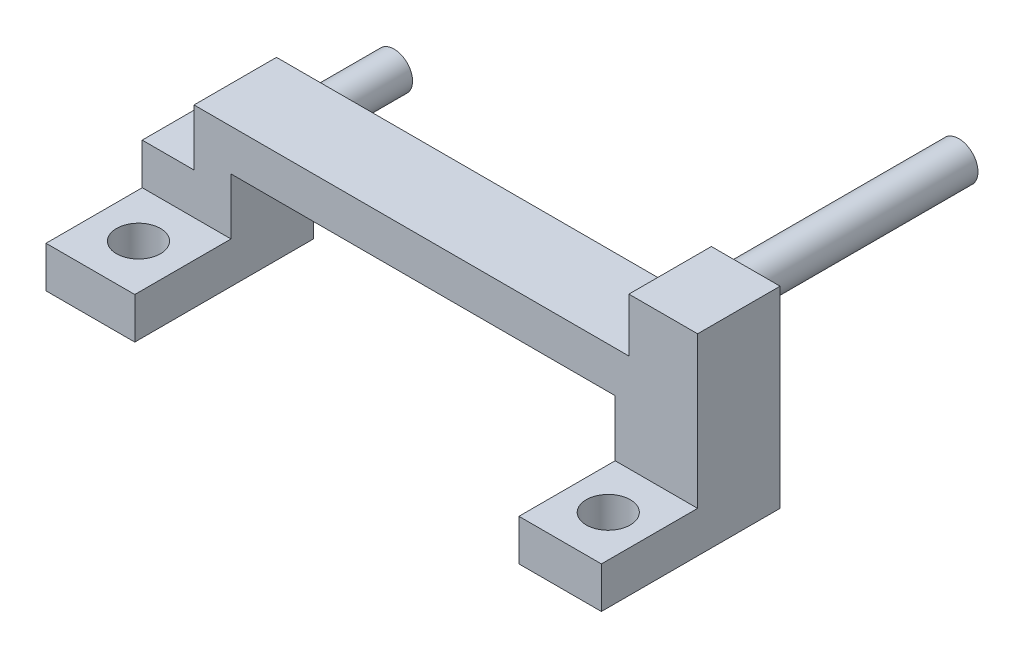
from build123d import *

# Parameters (mm, degrees)
SKETCH1_W            = 4
SKETCH1_H            = 14
BOSS_EXTRUDE1_DEPTH  = 3
SKETCH2_R            = 1.4
BOSS_EXTRUDE2_DEPTH  = 16
SKETCH3_W            = 4
SKETCH3_H            = 1
BOSS_EXTRUDE4_DEPTH  = 6
SKETCH7_W            = 3
SKETCH7_H            = 2
BOSS_EXTRUDE5_DEPTH  = 30.95
SKETCH8_W            = 3
SKETCH8_H            = 2
BOSS_EXTRUDE6_DEPTH  = 1
SKETCH9_W            = 1
SKETCH9_H            = 2
BOSS_EXTRUDE7_DEPTH  = 3
SKETCH10_W           = 1
SKETCH10_H           = 2
BOSS_EXTRUDE8_DEPTH  = 5.92
SKETCH11_W           = 1
SKETCH11_H           = 2
BOSS_EXTRUDE9_DEPTH  = 4
SKETCH12_W           = 1
SKETCH12_H           = 3
BOSS_EXTRUDE14_DEPTH = 0.93
SKETCH13_W           = 3
SKETCH13_H           = 3
BOSS_EXTRUDE15_DEPTH = 7.1
SKETCH14_W           = 3.33402541
SKETCH14_H           = 13.860919233
CUT_EXTRUDE3_DEPTH   = 10
SKETCH15_W           = 6.20666024
SKETCH15_H           = 3.660501205
CUT_EXTRUDE4_DEPTH   = 10
SKETCH16_W           = 3
SKETCH16_H           = 9.1
BOSS_EXTRUDE16_DEPTH = 0.12
SKETCH18_W           = 3
SKETCH18_H           = 9.1
BOSS_EXTRUDE18_DEPTH = 0.41
SKETCH19_W           = 3
SKETCH19_H           = 9.1
BOSS_EXTRUDE19_DEPTH = 0.89
SKETCH20_W           = 3
SKETCH20_H           = 6
BOSS_EXTRUDE20_DEPTH = 3.77
SKETCH21_R           = 1.35
BOSS_EXTRUDE23_DEPTH = 10
BOSS_EXTRUDE24_DEPTH = 3
SKETCH24_W           = 4
SKETCH24_H           = 1
BOSS_EXTRUDE25_DEPTH = 4
SKETCH25_W           = 4
SKETCH25_H           = 7
BOSS_EXTRUDE26_DEPTH = 2
SKETCH26_W           = 6.458993184
SKETCH26_H           = 3
BOSS_EXTRUDE27_DEPTH = 7
SKETCH27_R           = 1.6
CUT_EXTRUDE5_DEPTH   = 7
SKETCH28_R           = 1.6
CUT_EXTRUDE6_DEPTH   = 7
SKETCH30_W           = 7
SKETCH30_H           = 3
BOSS_EXTRUDE29_DEPTH = 1
SKETCH31_W           = 7
SKETCH31_H           = 3
BOSS_EXTRUDE30_DEPTH = 1
SKETCH32_W           = 6
SKETCH32_H           = 7.1
BOSS_EXTRUDE31_DEPTH = 1
SKETCH33_W           = 31.638993184
SKETCH33_H           = 6
BOSS_EXTRUDE32_DEPTH = 1
SKETCH34_W           = 6
SKETCH34_H           = 14
BOSS_EXTRUDE33_DEPTH = 1


with BuildPart() as part:
    # Sketch1 → Boss-Extrude1 (new body)
    with BuildSketch(Plane.XY):
        with Locations((-1.434146341, -3.597560976)):
            Rectangle(SKETCH1_W, SKETCH1_H)
    extrude(amount=BOSS_EXTRUDE1_DEPTH)

    # Sketch2 → Boss-Extrude2 (add)
    with BuildSketch(Plane(origin=(0, 0, 0), x_dir=(-1, 0, 0), z_dir=(0, 0, -1))):
        with Locations((1.434146341, 1.802439024)):
            Circle(SKETCH2_R)
    extrude(amount=BOSS_EXTRUDE2_DEPTH)

    # Sketch3 → Boss-Extrude4 (add)
    with BuildSketch(Plane.XY.offset(3)):
        with Locations((-1.434146341, -10.097560976)):
            Rectangle(SKETCH3_W, SKETCH3_H)
    extrude(amount=BOSS_EXTRUDE4_DEPTH)

    # Sketch7 → Boss-Extrude5 (add)
    with BuildSketch(Plane.ZY.offset(3.434146341)):
        with Locations((1.5, -2.497560976)):
            Rectangle(SKETCH7_W, SKETCH7_H)
    extrude(amount=BOSS_EXTRUDE5_DEPTH)

    # Sketch8 → Boss-Extrude6 (add)
    with BuildSketch(Plane.ZY.offset(34.384146341)):
        with Locations((1.5, -2.497560976)):
            Rectangle(SKETCH8_W, SKETCH8_H)
    extrude(amount=BOSS_EXTRUDE6_DEPTH)

    # Sketch9 → Boss-Extrude7 (add)
    with BuildSketch(Plane(origin=(0, 0, 0), x_dir=(-1, 0, 0), z_dir=(0, 0, -1))):
        with Locations((34.884146341, -2.497560976)):
            Rectangle(SKETCH9_W, SKETCH9_H)
    extrude(amount=BOSS_EXTRUDE7_DEPTH)

    # Sketch10 → Boss-Extrude8 (add)
    with BuildSketch(Plane(origin=(0, 0, -3), x_dir=(-1, 0, 0), z_dir=(0, 0, -1))):
        with Locations((34.884146341, -2.497560976)):
            Rectangle(SKETCH10_W, SKETCH10_H)
    extrude(amount=BOSS_EXTRUDE8_DEPTH)

    # Sketch11 → Boss-Extrude9 (add)
    with BuildSketch(Plane(origin=(0, 0, -8.92), x_dir=(-1, 0, 0), z_dir=(0, 0, -1))):
        with Locations((34.884146341, -2.497560976)):
            Rectangle(SKETCH11_W, SKETCH11_H)
    extrude(amount=BOSS_EXTRUDE9_DEPTH)

    # Sketch12 → Boss-Extrude14 (add)
    with BuildSketch(Plane.XZ.offset(3.497560976)):
        with Locations((-34.884146341, -9.28)):
            Rectangle(SKETCH12_W, SKETCH12_H)
    extrude(amount=BOSS_EXTRUDE14_DEPTH)

    # Sketch13 → Boss-Extrude15 (add)
    with BuildSketch(Plane.XZ.offset(3.497560976)):
        with Locations((-33.884146341, 1.5)):
            Rectangle(SKETCH13_W, SKETCH13_H)
    extrude(amount=BOSS_EXTRUDE15_DEPTH)

    # Sketch14 → Cut-Extrude3 (cut)
    with BuildSketch(Plane.XY.offset(3)):
        with Locations((-35.32015223, -3.66710136)):
            Rectangle(SKETCH14_W, SKETCH14_H)
    extrude(amount=-CUT_EXTRUDE3_DEPTH, mode=Mode.SUBTRACT)


with BuildPart() as cut_extrude3_piece_1:
    # of the separate pieces the step leaves, piece 1, a body of its own (cut_extrude3_pieces)
    add(part.part.solids().sort_by_distance((-3.434146341, 3.402439024, 0))[0])

    # Sketch16 → Boss-Extrude16 (add)
    with BuildSketch(Plane.ZY.offset(33.653139525)):
        with Locations((1.5, -6.047560976)):
            Rectangle(SKETCH16_W, SKETCH16_H)
    extrude(amount=BOSS_EXTRUDE16_DEPTH)

    # Sketch18 → Boss-Extrude18 (add)
    with BuildSketch(Plane.ZY.offset(33.773139525)):
        with Locations((1.5, -6.047560976)):
            Rectangle(SKETCH18_W, SKETCH18_H)
    extrude(amount=BOSS_EXTRUDE18_DEPTH)

    # Sketch19 → Boss-Extrude19 (add)
    with BuildSketch(Plane.ZY.offset(34.183139525)):
        with Locations((1.5, -6.047560976)):
            Rectangle(SKETCH19_W, SKETCH19_H)
    extrude(amount=BOSS_EXTRUDE19_DEPTH)

    # Sketch20 → Boss-Extrude20 (add)
    with BuildSketch(Plane.ZY.offset(35.073139525)):
        with Locations((1.5, -7.597560976)):
            Rectangle(SKETCH20_W, SKETCH20_H)
    extrude(amount=BOSS_EXTRUDE20_DEPTH)

    # Sketch21 → Boss-Extrude23 (add)
    with BuildSketch(Plane(origin=(0, 0, 0), x_dir=(-1, 0, 0), z_dir=(0, 0, -1))):
        with Locations((36.523139525, -7.047560976)):
            Circle(SKETCH21_R)
    extrude(amount=BOSS_EXTRUDE23_DEPTH)

    # Sketch23 → Boss-Extrude24 (add)
    with BuildSketch(Plane.XY.offset(3)):
        Polygon((-38.843139525, -10.597560976), (-38.843139525, -4.597560976), (-35.073139525, -4.597560976), (-35.073139525, -1.497560976), (-3.434146341, -1.497560976), (-3.434146341, 3.402439024), (0.565853659, 3.402439024), (0.565853659, -9.597560976), (-3.434146341, -9.597560976), (-3.434146341, -3.497560976), (-32.384146341, -3.497560976), (-32.384146341, -10.597560976), align=None)
    extrude(amount=BOSS_EXTRUDE24_DEPTH)

    # Sketch24 → Boss-Extrude25 (add)
    with BuildSketch(Plane.XY.offset(9)):
        with Locations((-1.434146341, -10.097560976)):
            Rectangle(SKETCH24_W, SKETCH24_H)
    extrude(amount=BOSS_EXTRUDE25_DEPTH)

    # Sketch25 → Boss-Extrude26 (add)
    with BuildSketch(Plane(origin=(0, -9.597560976, 0), x_dir=(1, 0, 0), z_dir=(0, 1, 0))):
        with Locations((-1.434146341, -9.5)):
            Rectangle(SKETCH25_W, SKETCH25_H)
    extrude(amount=BOSS_EXTRUDE26_DEPTH)

    # Sketch26 → Boss-Extrude27 (add)
    with BuildSketch(Plane.XY.offset(6)):
        with Locations((-35.613642933, -9.097560976)):
            Rectangle(SKETCH26_W, SKETCH26_H)
    extrude(amount=BOSS_EXTRUDE27_DEPTH)

    # Sketch27 → Cut-Extrude5 (cut)
    with BuildSketch(Plane(origin=(0, -7.597560976, 0), x_dir=(1, 0, 0), z_dir=(0, 1, 0))):
        with Locations((-35.613642933, -9.5)):
            Circle(SKETCH27_R)
    extrude(amount=-CUT_EXTRUDE5_DEPTH, mode=Mode.SUBTRACT)

    # Sketch28 → Cut-Extrude6 (cut)
    with BuildSketch(Plane(origin=(0, -7.597560976, 0), x_dir=(1, 0, 0), z_dir=(0, 1, 0))):
        with Locations((-1.434146341, -9.5)):
            Circle(SKETCH28_R)
    extrude(amount=-CUT_EXTRUDE6_DEPTH, mode=Mode.SUBTRACT)

    # Sketch30 → Boss-Extrude29 (add)
    with BuildSketch(Plane(origin=(0.565853659, 0, 0), x_dir=(0, 0, -1), z_dir=(1, 0, 0))):
        with Locations((-9.5, -9.097560976)):
            Rectangle(SKETCH30_W, SKETCH30_H)
    extrude(amount=BOSS_EXTRUDE29_DEPTH)

    # Sketch31 → Boss-Extrude30 (add)
    with BuildSketch(Plane.ZY.offset(3.434146341)):
        with Locations((9.5, -9.097560976)):
            Rectangle(SKETCH31_W, SKETCH31_H)
    extrude(amount=BOSS_EXTRUDE30_DEPTH)

    # Sketch32 → Boss-Extrude31 (add)
    with BuildSketch(Plane.ZY.offset(3.434146341)):
        with Locations((3, -7.047560976)):
            Rectangle(SKETCH32_W, SKETCH32_H)
    extrude(amount=BOSS_EXTRUDE31_DEPTH)

    # Sketch33 → Boss-Extrude32 (add)
    with BuildSketch(Plane(origin=(0, -1.497560976, 0), x_dir=(1, 0, 0), z_dir=(0, 1, 0))):
        with Locations((-19.253642933, -3)):
            Rectangle(SKETCH33_W, SKETCH33_H)
    extrude(amount=BOSS_EXTRUDE32_DEPTH)

    # Sketch34 → Boss-Extrude33 (add)
    with BuildSketch(Plane(origin=(0.565853659, 0, 0), x_dir=(0, 0, -1), z_dir=(1, 0, 0))):
        with Locations((-3, -3.597560976)):
            Rectangle(SKETCH34_W, SKETCH34_H)
    extrude(amount=BOSS_EXTRUDE33_DEPTH)


with BuildPart() as cut_extrude3_piece_2:
    # of the separate pieces the step leaves, piece 2, a body of its own (cut_extrude3_pieces)
    add(part.part.solids().sort_by_distance((-34.384146341, -1.497560976, -7))[0])

    # Sketch15 → Cut-Extrude4 (cut)
    with BuildSketch(Plane.ZY.offset(35.384146341)):
        with Locations((-9.81666988, -3.327811578)):
            Rectangle(SKETCH15_W, SKETCH15_H)
    extrude(amount=-CUT_EXTRUDE4_DEPTH, mode=Mode.SUBTRACT)


solid = cut_extrude3_piece_1.part
